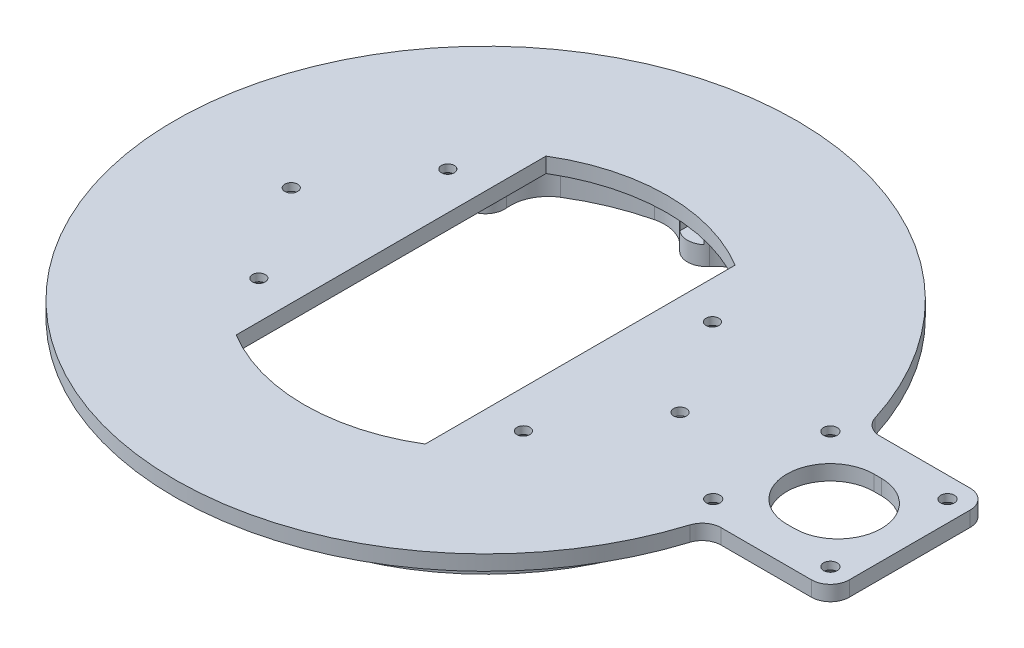
from build123d import *

# Parameters (mm, degrees)
ESBO_O1_R                  = 63.4
ESBO_O1_R_2                = 60.4
RESSALTO_EXTRUS_O1_DEPTH   = 14
ESBO_O2_R                  = 66
ESBO_O2_R_2                = 63.4
RESSALTO_EXTRUS_O2_DEPTH   = 5.2
RESSALTO_EXTRUS_O3_START   = -14
ESBO_O3_R                  = 1.6
RESSALTO_EXTRUS_O3_DEPTH   = 14
FILETE1_R                  = 10
ESBO_O4_R                  = 82.26
RESSALTO_EXTRUS_O4_DEPTH   = 4
CORTE_EXTRUS_O1_REACH      = 119.718
CORTE_EXTRUS_O2_REACH      = 119.718
ESBO_O6_R                  = 1.7
RESSALTO_EXTRUS_O5_START   = -4
RESSALTO_EXTRUS_O5_DEPTH   = 4
CORTE_EXTRUS_O3_REACH      = 142.284
ESBO_O8_R                  = 11.5
CORTE_EXTRUS_O4_REACH      = 142.284
ESBO_O9_R                  = 1.8
FILETE2_R                  = 5
CHANFRO1_SIZE              = 2
CORTE_EXTRUS_O5_DEPTH      = 2
CORTE_EXTRUS_O5_DEPTH_BACK = 2
CORTE_EXTRUS_O6_START      = -7.8
CORTE_EXTRUS_O6_DEPTH      = 2.8
CORTE_EXTRUS_O7_START      = -10
CORTE_EXTRUS_O7_DEPTH      = 10
CHANFRO2_SIZE              = 2
CORTE_EXTRUS_O8_DEPTH      = 10
PADR_OCIRCULAR1_COUNT      = 8


with BuildPart() as part:
    # Esboço1 → Ressalto-extrusão1 (new body)
    with BuildSketch(Plane(origin=(0, 0, 0), x_dir=(1, 0, 0), z_dir=(0, 1, 0))):
        with Locations(Location((0, 0, 0), (0, 0, 270))):
            Circle(ESBO_O1_R)
        with Locations(Location((0, 0, 0), (0, 0, 270))):
            Circle(ESBO_O1_R_2, mode=Mode.SUBTRACT)
    extrude(amount=-RESSALTO_EXTRUS_O1_DEPTH)

    # Esboço2 → Ressalto-extrusão2 (add)
    with BuildSketch(Plane(origin=(0, 0, 0), x_dir=(1, 0, 0), z_dir=(0, 1, 0))):
        with Locations(Location((0, 0, 0), (0, 0, 270))):
            Circle(ESBO_O2_R)
        with Locations(Location((0, 0, 0), (0, 0, 270))):
            Circle(ESBO_O2_R_2, mode=Mode.SUBTRACT)
    extrude(amount=-RESSALTO_EXTRUS_O2_DEPTH)

    # Esboço3 → Ressalto-extrusão3 (add)
    # profile 1 of 8: a face of its own
    with BuildSketch(Plane.XZ.offset(14).offset(RESSALTO_EXTRUS_O3_START)):
        with BuildLine():
            ThreePointArc((-60.220205479, -4.65691443), (-53.4, 0), (-60.220205479, 4.65691443))
            ThreePointArc((-60.220205479, 4.65691443), (-60.4, 0), (-60.220205479, -4.65691443))
        make_face()
        with Locations(Location((-58.4, 0, 0), (0, 0, 270))):
            Circle(ESBO_O3_R, mode=Mode.SUBTRACT)
    # profile 2 of 8: a face of its own
    with BuildSketch(Plane.XZ.offset(14).offset(RESSALTO_EXTRUS_O3_START)):
        with BuildLine():
            ThreePointArc((-45.875051432, 39.289179886), (-37.759502115, 37.759502115), (-39.289179886, 45.875051432))
            ThreePointArc((-39.289179886, 45.875051432), (-42.709249584, 42.709249584), (-45.875051432, 39.289179886))
        make_face()
        with Locations(Location((-41.295036021, 41.295036021, 0), (0, 0, 270))):
            Circle(ESBO_O3_R, mode=Mode.SUBTRACT)
    # profile 3 of 8: a face of its own
    with BuildSketch(Plane.XZ.offset(14).offset(RESSALTO_EXTRUS_O3_START)):
        with BuildLine():
            ThreePointArc((-4.65691443, 60.220205479), (0, 53.4), (4.65691443, 60.220205479))
            ThreePointArc((4.65691443, 60.220205479), (0, 60.4), (-4.65691443, 60.220205479))
        make_face()
        with Locations(Location((0, 58.4, 0), (0, 0, 270))):
            Circle(ESBO_O3_R, mode=Mode.SUBTRACT)
    # profile 4 of 8: a face of its own
    with BuildSketch(Plane.XZ.offset(14).offset(RESSALTO_EXTRUS_O3_START)):
        with BuildLine():
            ThreePointArc((39.289179886, 45.875051432), (37.759502115, 37.759502115), (45.875051432, 39.289179886))
            ThreePointArc((45.875051432, 39.289179886), (42.709249584, 42.709249584), (39.289179886, 45.875051432))
        make_face()
        with Locations(Location((41.295036021, 41.295036021, 0), (0, 0, 270))):
            Circle(ESBO_O3_R, mode=Mode.SUBTRACT)
    # profile 5 of 8: a face of its own
    with BuildSketch(Plane.XZ.offset(14).offset(RESSALTO_EXTRUS_O3_START)):
        with BuildLine():
            ThreePointArc((60.220205479, 4.65691443), (53.4, 0), (60.220205479, -4.65691443))
            ThreePointArc((60.220205479, -4.65691443), (60.4, 0), (60.220205479, 4.65691443))
        make_face()
        with Locations(Location((58.4, 0, 0), (0, 0, 270))):
            Circle(ESBO_O3_R, mode=Mode.SUBTRACT)
    # profile 6 of 8: a face of its own
    with BuildSketch(Plane.XZ.offset(14).offset(RESSALTO_EXTRUS_O3_START)):
        with BuildLine():
            ThreePointArc((45.875051432, -39.289179886), (37.759502115, -37.759502115), (39.289179886, -45.875051432))
            ThreePointArc((39.289179886, -45.875051432), (42.709249584, -42.709249584), (45.875051432, -39.289179886))
        make_face()
        with Locations(Location((41.295036021, -41.295036021, 0), (0, 0, 270))):
            Circle(ESBO_O3_R, mode=Mode.SUBTRACT)
    # profile 7 of 8: a face of its own
    with BuildSketch(Plane.XZ.offset(14).offset(RESSALTO_EXTRUS_O3_START)):
        with BuildLine():
            ThreePointArc((4.65691443, -60.220205479), (0, -53.4), (-4.65691443, -60.220205479))
            ThreePointArc((-4.65691443, -60.220205479), (0, -60.4), (4.65691443, -60.220205479))
        make_face()
        with Locations(Location((0, -58.4, 0), (0, 0, 270))):
            Circle(ESBO_O3_R, mode=Mode.SUBTRACT)
    # profile 8 of 8: a face of its own
    with BuildSketch(Plane.XZ.offset(14).offset(RESSALTO_EXTRUS_O3_START)):
        with BuildLine():
            ThreePointArc((-39.289179886, -45.875051432), (-37.759502115, -37.759502115), (-45.875051432, -39.289179886))
            ThreePointArc((-45.875051432, -39.289179886), (-42.709249584, -42.709249584), (-39.289179886, -45.875051432))
        make_face()
        with Locations(Location((-41.295036021, -41.295036021, 0), (0, 0, 270))):
            Circle(ESBO_O3_R, mode=Mode.SUBTRACT)
    extrude(amount=RESSALTO_EXTRUS_O3_DEPTH)

    # Filete1
    filete1_edges = [part.edges().sort_by_distance(p)[0] for p in [
        (-60.220205479, -7, -4.65691443),
        (-60.220205479, -7, 4.65691443),
        (-45.875051432, -7, 39.289179886),
        (-39.289179886, -7, 45.875051432),
        (-4.65691443, -7, 60.220205479),
        (4.65691443, -7, 60.220205479),
        (39.289179886, -7, 45.875051432),
        (45.875051432, -7, 39.289179886),
        (60.220205479, -7, 4.65691443),
        (60.220205479, -7, -4.65691443),
        (45.875051432, -7, -39.289179886),
        (39.289179886, -7, -45.875051432),
        (4.65691443, -7, -60.220205479),
        (-4.65691443, -7, -60.220205479),
        (-39.289179886, -7, -45.875051432),
        (-45.875051432, -7, -39.289179886),
    ]]
    fillet(filete1_edges, radius=FILETE1_R)

    # Esboço4 → Ressalto-extrusão4 (add)
    with BuildSketch(Plane(origin=(0, 0, 0), x_dir=(1, 0, 0), z_dir=(0, 1, 0))):
        with Locations(Location((0, 0, 0), (0, 0, 270))):
            Circle(ESBO_O4_R)
    extrude(amount=RESSALTO_EXTRUS_O4_DEPTH)

    # Esboço5 → Corte-extrusão1 (cut, up to next)
    with BuildSketch(Plane(origin=(0, 4, 0), x_dir=(1, 0, 0), z_dir=(0, 1, 0)), mode=Mode.PRIVATE) as corte_extrus_o1_sk1:
        with BuildLine():
            Line((-25, 40.975602497), (-25, -40.975602497))
            ThreePointArc((-25, -40.975602497), (0, -48), (25, -40.975602497))
            Line((25, -40.975602497), (25, 40.975602497))
            ThreePointArc((25, 40.975602497), (0, 48), (-25, 40.975602497))
        make_face()
    corte_extrus_o1_tool1 = extrude(corte_extrus_o1_sk1.sketch, amount=-CORTE_EXTRUS_O1_REACH, mode=Mode.PRIVATE) & part.part
    add(corte_extrus_o1_tool1.solids().sort_by_distance((0, 4, 0))[0], mode=Mode.SUBTRACT)

    # Esboço6 → Corte-extrusão2 (cut, up to next)
    with BuildSketch(Plane(origin=(0, 4, 0), x_dir=(1, 0, 0), z_dir=(0, 1, 0)), mode=Mode.PRIVATE) as corte_extrus_o2_sk1:
        with Locations(Location((-35, 25, 0), (0, 0, 270))):
            Circle(ESBO_O6_R)
    corte_extrus_o2_tool1 = extrude(corte_extrus_o2_sk1.sketch, amount=-CORTE_EXTRUS_O2_REACH, mode=Mode.PRIVATE) & part.part
    # Esboço6 → Corte-extrusão2 (cut, up to next)
    with BuildSketch(Plane(origin=(0, 4, 0), x_dir=(1, 0, 0), z_dir=(0, 1, 0)), mode=Mode.PRIVATE) as corte_extrus_o2_sk2:
        with Locations(Location((35, 25, 0), (0, 0, 270))):
            Circle(ESBO_O6_R)
    corte_extrus_o2_tool2 = extrude(corte_extrus_o2_sk2.sketch, amount=-CORTE_EXTRUS_O2_REACH, mode=Mode.PRIVATE) & part.part
    # Esboço6 → Corte-extrusão2 (cut, up to next)
    with BuildSketch(Plane(origin=(0, 4, 0), x_dir=(1, 0, 0), z_dir=(0, 1, 0)), mode=Mode.PRIVATE) as corte_extrus_o2_sk3:
        with Locations(Location((35, -25, 0), (0, 0, 270))):
            Circle(ESBO_O6_R)
    corte_extrus_o2_tool3 = extrude(corte_extrus_o2_sk3.sketch, amount=-CORTE_EXTRUS_O2_REACH, mode=Mode.PRIVATE) & part.part
    # Esboço6 → Corte-extrusão2 (cut, up to next)
    with BuildSketch(Plane(origin=(0, 4, 0), x_dir=(1, 0, 0), z_dir=(0, 1, 0)), mode=Mode.PRIVATE) as corte_extrus_o2_sk4:
        with Locations(Location((-35, -25, 0), (0, 0, 270))):
            Circle(ESBO_O6_R)
    corte_extrus_o2_tool4 = extrude(corte_extrus_o2_sk4.sketch, amount=-CORTE_EXTRUS_O2_REACH, mode=Mode.PRIVATE) & part.part
    # Esboço6 → Corte-extrusão2 (cut, up to next)
    with BuildSketch(Plane(origin=(0, 4, 0), x_dir=(1, 0, 0), z_dir=(0, 1, 0)), mode=Mode.PRIVATE) as corte_extrus_o2_sk5:
        with Locations(Location((-51.43, 0, 0), (0, 0, 270))):
            Circle(ESBO_O6_R)
    corte_extrus_o2_tool5 = extrude(corte_extrus_o2_sk5.sketch, amount=-CORTE_EXTRUS_O2_REACH, mode=Mode.PRIVATE) & part.part
    # Esboço6 → Corte-extrusão2 (cut, up to next)
    with BuildSketch(Plane(origin=(0, 4, 0), x_dir=(1, 0, 0), z_dir=(0, 1, 0)), mode=Mode.PRIVATE) as corte_extrus_o2_sk6:
        with Locations(Location((51.43, 0, 0), (0, 0, 270))):
            Circle(ESBO_O6_R)
    corte_extrus_o2_tool6 = extrude(corte_extrus_o2_sk6.sketch, amount=-CORTE_EXTRUS_O2_REACH, mode=Mode.PRIVATE) & part.part
    add(corte_extrus_o2_tool1.solids().sort_by_distance((-35, 4, -25))[0], mode=Mode.SUBTRACT)
    add(corte_extrus_o2_tool2.solids().sort_by_distance((35, 4, -25))[0], mode=Mode.SUBTRACT)
    add(corte_extrus_o2_tool3.solids().sort_by_distance((35, 4, 25))[0], mode=Mode.SUBTRACT)
    add(corte_extrus_o2_tool4.solids().sort_by_distance((-35, 4, 25))[0], mode=Mode.SUBTRACT)
    add(corte_extrus_o2_tool5.solids().sort_by_distance((-51.43, 4, 0))[0], mode=Mode.SUBTRACT)
    add(corte_extrus_o2_tool6.solids().sort_by_distance((51.43, 4, 0))[0], mode=Mode.SUBTRACT)

    # Esboço7 → Ressalto-extrusão5 (add)
    with BuildSketch(Plane(origin=(0, 4, 0), x_dir=(1, 0, 0), z_dir=(0, 1, 0)).offset(RESSALTO_EXTRUS_O5_START)):
        with BuildLine():
            Line((79.534317122, 21), (112.2, 21))
            Line((112.2, 21), (112.2, -21))
            Line((112.2, -21), (79.534317122, -21))
            ThreePointArc((79.534317122, -21), (81.062443757, -13.985271257), (81.973122807, -6.864017575))
            ThreePointArc((81.973122807, -6.864017575), (102.7, 0), (81.973122807, 6.864017575))
            ThreePointArc((81.973122807, 6.864017575), (81.062443757, 13.985271257), (79.534317122, 21))
        make_face()
    extrude(amount=RESSALTO_EXTRUS_O5_DEPTH)

    # Esboço8 → Corte-extrusão3 (cut, up to next)
    with BuildSketch(Plane(origin=(0, 4, 0), x_dir=(1, 0, 0), z_dir=(0, 1, 0)), mode=Mode.PRIVATE) as corte_extrus_o3_sk1:
        with Locations(Location((91.2, 0, 0), (0, 0, 270))):
            Circle(ESBO_O8_R)
    corte_extrus_o3_tool1 = extrude(corte_extrus_o3_sk1.sketch, amount=-CORTE_EXTRUS_O3_REACH, mode=Mode.PRIVATE) & part.part
    add(corte_extrus_o3_tool1.solids().sort_by_distance((91.2, 4, 0))[0], mode=Mode.SUBTRACT)

    # Esboço9 → Corte-extrusão4 (cut, up to next)
    with BuildSketch(Plane(origin=(0, 4, 0), x_dir=(1, 0, 0), z_dir=(0, 1, 0)), mode=Mode.PRIVATE) as corte_extrus_o4_sk1:
        with Locations(Location((75.7, 15.5, 0), (0, 0, 270))):
            Circle(ESBO_O9_R)
    corte_extrus_o4_tool1 = extrude(corte_extrus_o4_sk1.sketch, amount=-CORTE_EXTRUS_O4_REACH, mode=Mode.PRIVATE) & part.part
    # Esboço9 → Corte-extrusão4 (cut, up to next)
    with BuildSketch(Plane(origin=(0, 4, 0), x_dir=(1, 0, 0), z_dir=(0, 1, 0)), mode=Mode.PRIVATE) as corte_extrus_o4_sk2:
        with Locations(Location((106.7, 15.5, 0), (0, 0, 270))):
            Circle(ESBO_O9_R)
    corte_extrus_o4_tool2 = extrude(corte_extrus_o4_sk2.sketch, amount=-CORTE_EXTRUS_O4_REACH, mode=Mode.PRIVATE) & part.part
    # Esboço9 → Corte-extrusão4 (cut, up to next)
    with BuildSketch(Plane(origin=(0, 4, 0), x_dir=(1, 0, 0), z_dir=(0, 1, 0)), mode=Mode.PRIVATE) as corte_extrus_o4_sk3:
        with Locations(Location((106.7, -15.5, 0), (0, 0, 270))):
            Circle(ESBO_O9_R)
    corte_extrus_o4_tool3 = extrude(corte_extrus_o4_sk3.sketch, amount=-CORTE_EXTRUS_O4_REACH, mode=Mode.PRIVATE) & part.part
    # Esboço9 → Corte-extrusão4 (cut, up to next)
    with BuildSketch(Plane(origin=(0, 4, 0), x_dir=(1, 0, 0), z_dir=(0, 1, 0)), mode=Mode.PRIVATE) as corte_extrus_o4_sk4:
        with Locations(Location((75.7, -15.5, 0), (0, 0, 270))):
            Circle(ESBO_O9_R)
    corte_extrus_o4_tool4 = extrude(corte_extrus_o4_sk4.sketch, amount=-CORTE_EXTRUS_O4_REACH, mode=Mode.PRIVATE) & part.part
    add(corte_extrus_o4_tool1.solids().sort_by_distance((75.7, 4, -15.5))[0], mode=Mode.SUBTRACT)
    add(corte_extrus_o4_tool2.solids().sort_by_distance((106.7, 4, -15.5))[0], mode=Mode.SUBTRACT)
    add(corte_extrus_o4_tool3.solids().sort_by_distance((106.7, 4, 15.5))[0], mode=Mode.SUBTRACT)
    add(corte_extrus_o4_tool4.solids().sort_by_distance((75.7, 4, 15.5))[0], mode=Mode.SUBTRACT)

    # Filete2
    filete2_edges = [part.edges().sort_by_distance(p)[0] for p in [
        (79.534317122, 2, -21),
        (112.2, 2, -21),
        (112.2, 2, 21),
        (79.534317122, 2, 21),
    ]]
    fillet(filete2_edges, radius=FILETE2_R)

    # Chanfro1
    chanfro1_edges = [part.edges().sort_by_distance(p)[0] for p in [
        (-35, 0, 23.3),
        (35, 0, 23.3),
        (35, 0, -26.7),
        (-35, 0, -26.7),
    ]]
    chamfer(chanfro1_edges, length=CHANFRO1_SIZE)

    # Esboço10 → Corte-extrusão5 (cut, two sides: drawn at the far end of the back side and taken through both)
    with BuildSketch(Plane.XZ.offset(-CORTE_EXTRUS_O5_DEPTH_BACK)):
        Polygon((-54.18, 1.58771324), (-54.18, -1.58771324), (-51.43, -3.175426481), (-48.68, -1.58771324), (-48.68, 1.58771324), (-51.43, 3.175426481), align=None)
        Polygon((51.43, 3.175426481), (54.18, 1.58771324), (54.18, -1.58771324), (51.43, -3.175426481), (48.68, -1.58771324), (48.68, 1.58771324), align=None)
    extrude(amount=CORTE_EXTRUS_O5_DEPTH + CORTE_EXTRUS_O5_DEPTH_BACK, mode=Mode.SUBTRACT)

    # Esboço11 → Corte-extrusão6 (cut)
    with BuildSketch(Plane.XZ.offset(14).offset(CORTE_EXTRUS_O6_START)):
        with BuildLine():
            Line((-61.15, 1.58771324), (-61.15, -1.58771324))
            Line((-61.15, -1.58771324), (-58.4, -3.175426481))
            Line((-58.4, -3.175426481), (-54.537789925, -3.175426481))
            ThreePointArc((-54.537789925, -3.175426481), (-53.4, 0), (-54.537789925, 3.175426481))
            Line((-54.537789925, 3.175426481), (-58.4, 3.175426481))
            Line((-58.4, 3.175426481), (-61.15, 1.58771324))
        make_face()
        with BuildLine():
            Line((-39.049670424, 43.540401619), (-36.318675489, 40.809406684))
            ThreePointArc((-36.318675489, 40.809406684), (-37.759502115, 37.759502115), (-40.809406684, 36.318675489))
            Line((-40.809406684, 36.318675489), (-43.540401619, 39.049670424))
            Line((-43.540401619, 39.049670424), (-44.362262468, 42.116896871))
            Line((-44.362262468, 42.116896871), (-42.116896871, 44.362262468))
            Line((-42.116896871, 44.362262468), (-39.049670424, 43.540401619))
        make_face()
        with BuildLine():
            Line((3.175426481, 58.4), (3.175426481, 54.537789925))
            ThreePointArc((3.175426481, 54.537789925), (0, 53.4), (-3.175426481, 54.537789925))
            Line((-3.175426481, 54.537789925), (-3.175426481, 58.4))
            Line((-3.175426481, 58.4), (-1.58771324, 61.15))
            Line((-1.58771324, 61.15), (1.58771324, 61.15))
            Line((1.58771324, 61.15), (3.175426481, 58.4))
        make_face()
        with BuildLine():
            Line((43.540401619, 39.049670424), (40.809406684, 36.318675489))
            ThreePointArc((40.809406684, 36.318675489), (37.759502115, 37.759502115), (36.318675489, 40.809406684))
            Line((36.318675489, 40.809406684), (39.049670424, 43.540401619))
            Line((39.049670424, 43.540401619), (42.116896871, 44.362262468))
            Line((42.116896871, 44.362262468), (44.362262468, 42.116896871))
            Line((44.362262468, 42.116896871), (43.540401619, 39.049670424))
        make_face()
        with BuildLine():
            Line((58.4, -3.175426481), (54.537789925, -3.175426481))
            ThreePointArc((54.537789925, -3.175426481), (53.4, 0), (54.537789925, 3.175426481))
            Line((54.537789925, 3.175426481), (58.4, 3.175426481))
            Line((58.4, 3.175426481), (61.15, 1.58771324))
            Line((61.15, 1.58771324), (61.15, -1.58771324))
            Line((61.15, -1.58771324), (58.4, -3.175426481))
        make_face()
        with BuildLine():
            Line((39.049670424, -43.540401619), (36.318675489, -40.809406684))
            ThreePointArc((36.318675489, -40.809406684), (37.759502115, -37.759502115), (40.809406684, -36.318675489))
            Line((40.809406684, -36.318675489), (43.540401619, -39.049670424))
            Line((43.540401619, -39.049670424), (44.362262468, -42.116896871))
            Line((44.362262468, -42.116896871), (42.116896871, -44.362262468))
            Line((42.116896871, -44.362262468), (39.049670424, -43.540401619))
        make_face()
        with BuildLine():
            Line((-3.175426481, -58.4), (-3.175426481, -54.537789925))
            ThreePointArc((-3.175426481, -54.537789925), (0, -53.4), (3.175426481, -54.537789925))
            Line((3.175426481, -54.537789925), (3.175426481, -58.4))
            Line((3.175426481, -58.4), (1.58771324, -61.15))
            Line((1.58771324, -61.15), (-1.58771324, -61.15))
            Line((-1.58771324, -61.15), (-3.175426481, -58.4))
        make_face()
        with BuildLine():
            Line((-43.540401619, -39.049670424), (-40.809406684, -36.318675489))
            ThreePointArc((-40.809406684, -36.318675489), (-37.759502115, -37.759502115), (-36.318675489, -40.809406684))
            Line((-36.318675489, -40.809406684), (-39.049670424, -43.540401619))
            Line((-39.049670424, -43.540401619), (-42.116896871, -44.362262468))
            Line((-42.116896871, -44.362262468), (-44.362262468, -42.116896871))
            Line((-44.362262468, -42.116896871), (-43.540401619, -39.049670424))
        make_face()
    extrude(amount=CORTE_EXTRUS_O6_DEPTH, mode=Mode.SUBTRACT)

    # Esboço12 → Corte-extrusão7 (cut)
    with BuildSketch(Plane(origin=(0, 4, 0), x_dir=(1, 0, 0), z_dir=(0, 1, 0)).offset(CORTE_EXTRUS_O7_START)):
        with BuildLine():
            Line((91.2, 11.5), (93.2, 11.5))
            ThreePointArc((93.2, 11.5), (104.7, 0), (93.2, -11.5))
            Line((93.2, -11.5), (91.2, -11.5))
            ThreePointArc((91.2, -11.5), (79.7, 0), (91.2, 11.5))
        make_face()
    extrude(amount=CORTE_EXTRUS_O7_DEPTH, mode=Mode.SUBTRACT)

    # Chanfro2
    chanfro2_edges = [part.edges().sort_by_distance(p)[0] for p in [
        (75.7, 0, 13.7),
        (106.7, 0, 13.7),
        (106.7, 0, -17.3),
        (75.7, 0, -17.3),
    ]]
    chamfer(chanfro2_edges, length=CHANFRO2_SIZE)

    # Esboço13 → Corte-extrusão8 (cut)
    with BuildSketch(Plane(origin=(-43.23957967, 0, -43.23957967), x_dir=(0.7071067811865487, 0, -0.7071067811865465), z_dir=(0.7071067811865465, 0, 0.7071067811865487))):
        Polygon((-3.175426481, -6.2), (3.175426481, -6.2), (0, -5.2), align=None)
    corte_extrus_o8 = extrude(amount=CORTE_EXTRUS_O8_DEPTH, mode=Mode.SUBTRACT)

    # PadrãoCircular1: Corte-extrusão8 ×8 about axis
    padr_ocircular1_axis = Axis((0, 0, 0), (0, 1, 0))
    for i in range(1, PADR_OCIRCULAR1_COUNT):
        add(corte_extrus_o8.rotate(padr_ocircular1_axis, i * 360 / PADR_OCIRCULAR1_COUNT), mode=Mode.SUBTRACT)


solid = part.part
